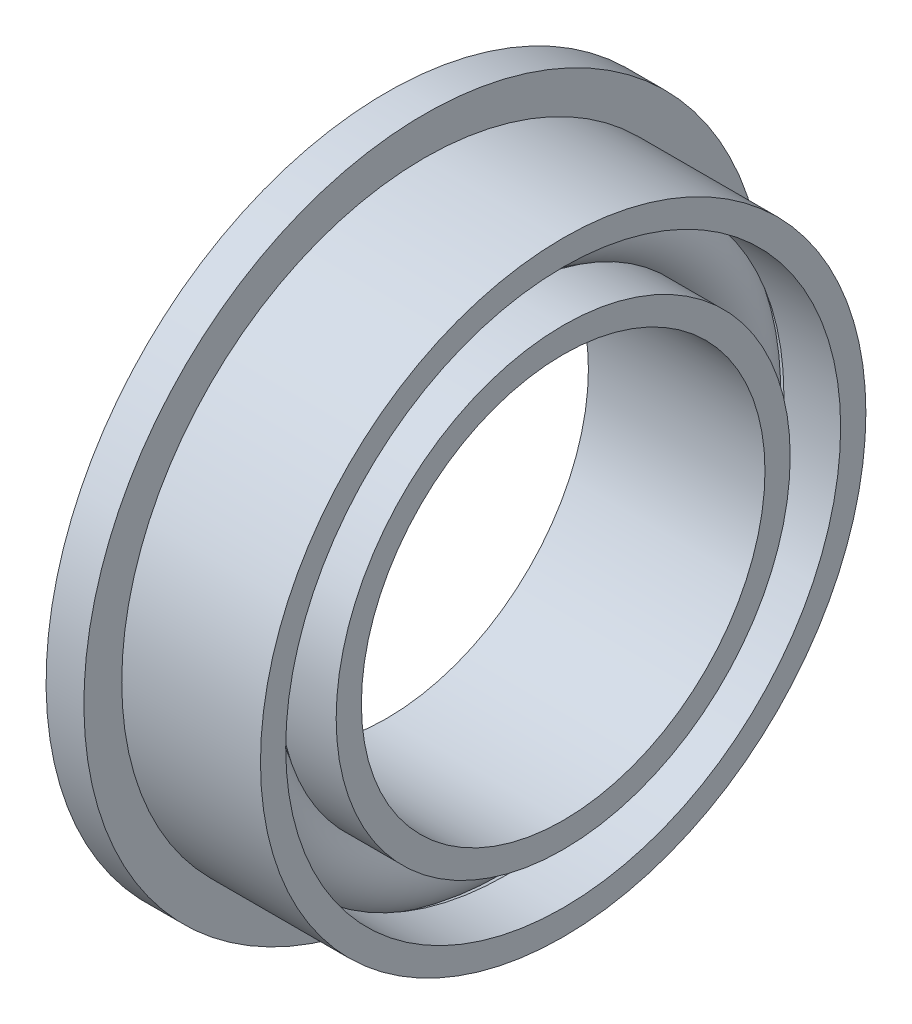
from build123d import *

# Parameters (mm, degrees)
SKETCH1_3_R = 0.75


with BuildPart() as part:
    # Sketch1 → Revolve1 (revolve)
    with BuildSketch(Plane.XY):
        with BuildLine():
            Line((-1, 6), (-1, 6.75))
            Line((-1, 6.75), (-1.75, 6.75))
            Line((-1.75, 6.75), (-1.75, 5.5))
            Line((-1.75, 5.5), (-0.6244998, 5.5))
            ThreePointArc((-0.6244998, 5.5), (0, 5.8), (0.6244998, 5.5))
            Line((0.6244998, 5.5), (1.75, 5.5))
            Line((1.75, 5.5), (1.75, 6))
            Line((1.75, 6), (-1, 6))
        make_face()
        with BuildLine():
            Line((-0.6244998, 4.5), (-1.75, 4.5))
            Line((-1.75, 4.5), (-1.75, 4))
            Line((-1.75, 4), (1.75, 4))
            Line((1.75, 4), (1.75, 4.5))
            Line((1.75, 4.5), (0.6244998, 4.5))
            ThreePointArc((0.6244998, 4.5), (0, 4.2), (-0.6244998, 4.5))
        make_face()
    revolve(axis=Axis((-42.111189303, 0, 0), (1, 0, 0)))


with BuildPart() as body_2:
    # Sketch1<3> → Revolve2 (revolve)
    with BuildSketch(Plane.XY):
        with Locations((0, 5)):
            Circle(SKETCH1_3_R)
    revolve(axis=Axis((-42.111189303, 0, 0), (1, 0, 0)))


solid = Compound([part.part, body_2.part])
